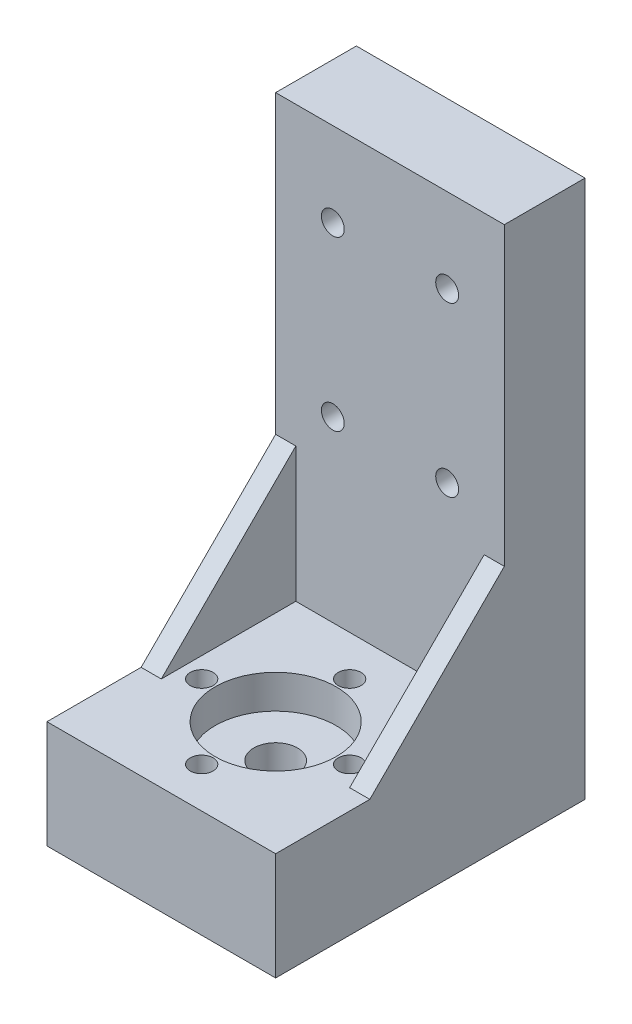
from build123d import *

# Parameters (mm, degrees)
SKETCH1_W           = 34
SKETCH1_H           = 34
BOSS_EXTRUDE1_DEPTH = 16
SKETCH2_W           = 34
SKETCH2_H           = 80
BOSS_EXTRUDE2_DEPTH = 12
SKETCH3_R           = 3.25
SKETCH3_R_2         = 1.7
CUT_EXTRUDE2_DEPTH  = 73.291078288
SKETCH4_R           = 9
CUT_EXTRUDE3_DEPTH  = 5
SKETCH5_R           = 1.7
CUT_EXTRUDE4_DEPTH  = 89.572004606
BOSS_EXTRUDE3_DEPTH = 3
BOSS_EXTRUDE4_DEPTH = 3


with BuildPart() as part:
    # Sketch1 → Boss-Extrude1 (new body)
    with BuildSketch(Plane(origin=(0, 0, 0), x_dir=(1, 0, 0), z_dir=(0, 1, 0))):
        Rectangle(SKETCH1_W, SKETCH1_H)
    extrude(amount=BOSS_EXTRUDE1_DEPTH)

    # Sketch2 → Boss-Extrude2 (add)
    with BuildSketch(Plane(origin=(0, 0, -17), x_dir=(-1, 0, 0), z_dir=(0, 0, -1))):
        with Locations((0, 40)):
            Rectangle(SKETCH2_W, SKETCH2_H)
    extrude(amount=BOSS_EXTRUDE2_DEPTH)

    # Sketch3 → Cut-Extrude2 (cut, through all)
    with BuildSketch(Plane(origin=(0, 16, 0), x_dir=(1, 0, 0), z_dir=(0, 1, 0))):
        with Locations(Location((0, 0, 0), (0, 0, 270))):
            Circle(SKETCH3_R)
        with Locations(Location((0, 11, 0), (0, 0, 270))):
            Circle(SKETCH3_R_2)
        with Locations(Location((11, 0, 0), (0, 0, 270))):
            Circle(SKETCH3_R_2)
        with Locations(Location((0, -11, 0), (0, 0, 270))):
            Circle(SKETCH3_R_2)
        with Locations(Location((-11, 0, 0), (0, 0, 270))):
            Circle(SKETCH3_R_2)
    extrude(amount=-CUT_EXTRUDE2_DEPTH, mode=Mode.SUBTRACT)

    # Sketch4 → Cut-Extrude3 (cut)
    with BuildSketch(Plane(origin=(0, 16, 0), x_dir=(1, 0, 0), z_dir=(0, 1, 0))):
        with Locations(Location((0, 0, 0), (0, 0, 270))):
            Circle(SKETCH4_R)
    extrude(amount=-CUT_EXTRUDE3_DEPTH, mode=Mode.SUBTRACT)

    # Sketch5 → Cut-Extrude4 (cut, through all)
    with BuildSketch(Plane.XY.offset(-17)):
        with Locations((-8.5, 67.5)):
            Circle(SKETCH5_R)
        with Locations((8.5, 67.5)):
            Circle(SKETCH5_R)
        with Locations((8.5, 42.5)):
            Circle(SKETCH5_R)
        with Locations((-8.5, 42.5)):
            Circle(SKETCH5_R)
    extrude(amount=-CUT_EXTRUDE4_DEPTH, mode=Mode.SUBTRACT)

    # Sketch6 → Boss-Extrude3 (add)
    with BuildSketch(Plane(origin=(17, 0, 0), x_dir=(0, 0, -1), z_dir=(1, 0, 0))):
        Polygon((17, 16), (-3, 16), (17, 36), align=None)
    extrude(amount=-BOSS_EXTRUDE3_DEPTH)

    # Sketch7 → Boss-Extrude4 (add)
    with BuildSketch(Plane.ZY.offset(17)):
        Polygon((-17, 16), (-17, 36), (3, 16), align=None)
    extrude(amount=-BOSS_EXTRUDE4_DEPTH)


solid = part.part
